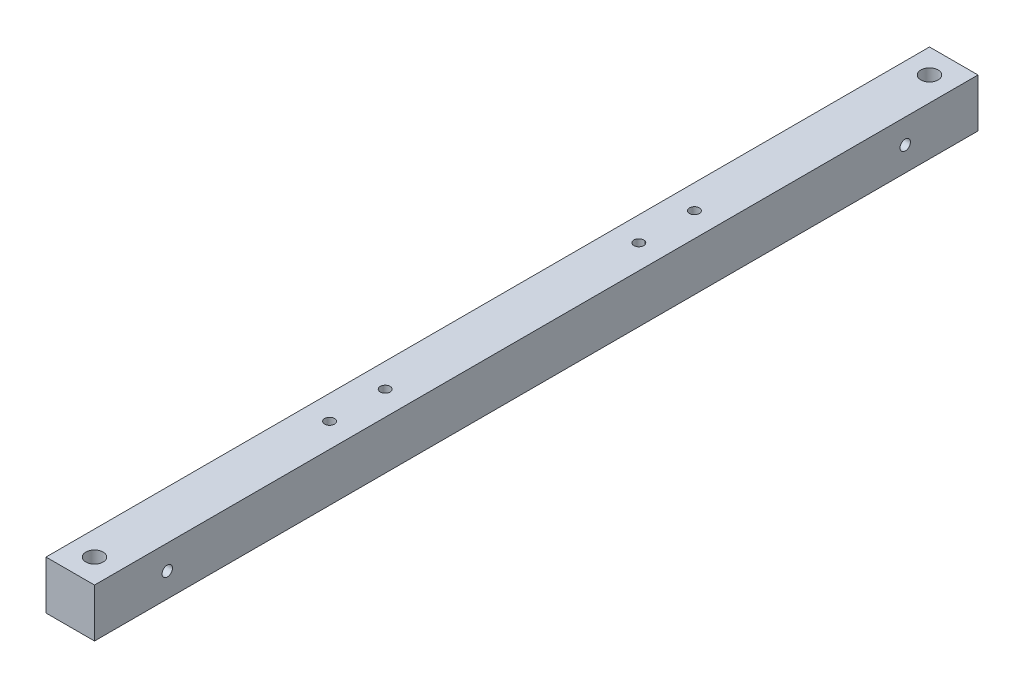
from build123d import *

# Parameters (mm, degrees)
IZIM1_W                     = 28
IZIM1_H                     = 28
Y_KSEKLIK_EKSTR_ZYON1_DEPTH = 255
IZIM2_R                     = 3
KES_EKSTR_ZYON1_DEPTH       = 40
IZIM4_R                     = 5
KES_EKSTR_ZYON2_DEPTH       = 7
KES_EKSTR_ZYON3_DEPTH       = 257.914382626
KES_EKSTR_ZYON3_DEPTH_BACK  = 257.914382626
IZIM5_R                     = 3
IZIM6_R                     = 5
KES_EKSTR_ZYON4_DEPTH       = 7
IZIM8_R                     = 2.85
KES_EKSTR_ZYON6_DEPTH       = 257.914382626


with BuildPart() as part:
    # Çizim1 → Yükseklik-Ekstrüzyon1 (new, symmetric)
    with BuildSketch(Plane.XY):
        Rectangle(IZIM1_W, IZIM1_H)
    extrude(amount=Y_KSEKLIK_EKSTR_ZYON1_DEPTH, both=True)

    # Çizim2 → Kes-Ekstrüzyon1 (cut)
    with BuildSketch(Plane(origin=(14, 0, 0), x_dir=(0, 0, -1), z_dir=(1, 0, 0))):
        with Locations((213, 0)):
            Circle(IZIM2_R)
        with Locations((-213, 0)):
            Circle(IZIM2_R)
    extrude(amount=-KES_EKSTR_ZYON1_DEPTH, mode=Mode.SUBTRACT)

    # Çizim4 → Kes-Ekstrüzyon2 (cut)
    with BuildSketch(Plane.ZY.offset(14)):
        with Locations((-213, 0)):
            Circle(IZIM4_R)
        with Locations((213, 0)):
            Circle(IZIM4_R)
    extrude(amount=-KES_EKSTR_ZYON2_DEPTH, mode=Mode.SUBTRACT)

    # Çizim5 → Kes-Ekstrüzyon3 (cut, two sides: drawn at the far end of the back side and taken through both)
    with BuildSketch(Plane(origin=(0, 14, 0), x_dir=(1, 0, 0), z_dir=(0, 1, 0)).offset(-KES_EKSTR_ZYON3_DEPTH_BACK)):
        with Locations(Location((0, -241, 0), (0, 0, 270))):
            Circle(IZIM5_R)
        with Locations(Location((0, 241, 0), (0, 0, 270))):
            Circle(IZIM5_R)
    extrude(amount=KES_EKSTR_ZYON3_DEPTH + KES_EKSTR_ZYON3_DEPTH_BACK, mode=Mode.SUBTRACT)

    # Çizim6 → Kes-Ekstrüzyon4 (cut)
    with BuildSketch(Plane(origin=(0, 14, 0), x_dir=(1, 0, 0), z_dir=(0, 1, 0))):
        with Locations(Location((0, 241, 0), (0, 0, 270))):
            Circle(IZIM6_R)
        with Locations(Location((0, -241, 0), (0, 0, 270))):
            Circle(IZIM6_R)
    extrude(amount=-KES_EKSTR_ZYON4_DEPTH, mode=Mode.SUBTRACT)

    # Çizim8 → Kes-Ekstrüzyon6 (cut, through all)
    with BuildSketch(Plane(origin=(0, 14, 0), x_dir=(1, 0, 0), z_dir=(0, 1, 0))):
        with Locations(Location((0, -105.3, 0), (0, 0, 270))):
            Circle(IZIM8_R)
        with Locations(Location((0, -73.2, 0), (0, 0, 270))):
            Circle(IZIM8_R)
        with Locations(Location((0, 73.2, 0), (0, 0, 90))):
            Circle(IZIM8_R)
        with Locations(Location((0, 105.3, 0), (0, 0, 90))):
            Circle(IZIM8_R)
    extrude(amount=-KES_EKSTR_ZYON6_DEPTH, mode=Mode.SUBTRACT)


solid = part.part
